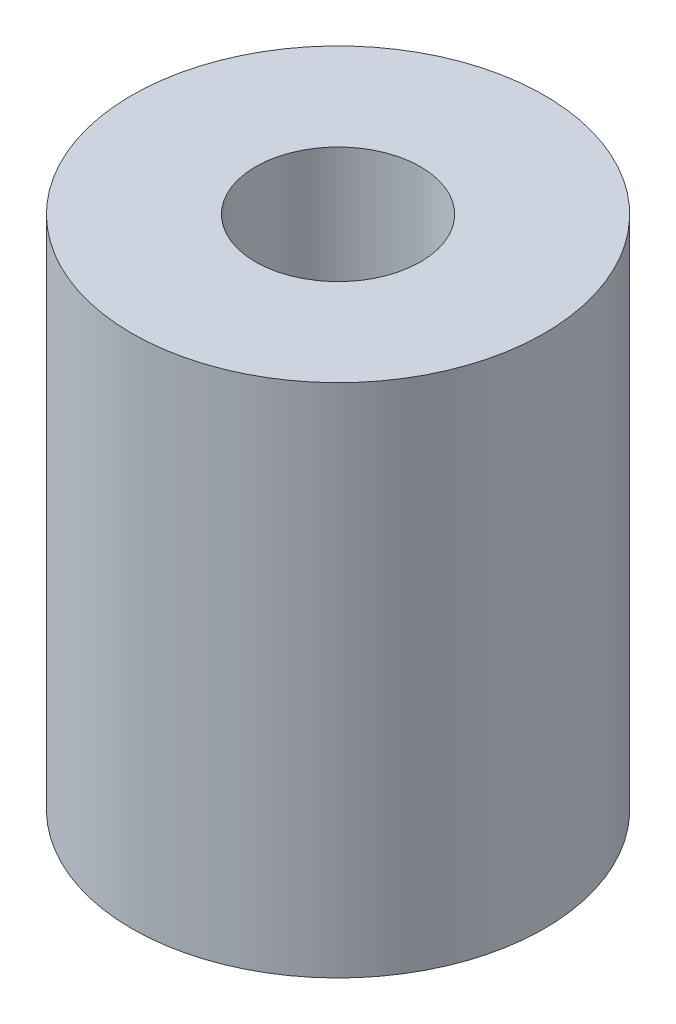
from build123d import *

# Parameters (mm, degrees)
SKETCH1_R           = 10
BOSS_EXTRUDE1_DEPTH = 25
SKETCH2_R           = 4
CUT_EXTRUDE1_DEPTH  = 9
SKETCH3_R           = 2.5
CUT_EXTRUDE2_DEPTH  = 11


with BuildPart() as part:
    # Sketch1 → Boss-Extrude1 (new body)
    with BuildSketch(Plane(origin=(0, 0, 0), x_dir=(1, 0, 0), z_dir=(0, 1, 0))):
        with Locations(Location((0, 0, 0), (0, 0, 270))):
            Circle(SKETCH1_R)
    extrude(amount=BOSS_EXTRUDE1_DEPTH)

    # Sketch2 → Cut-Extrude1 (cut)
    with BuildSketch(Plane(origin=(0, 25, 0), x_dir=(1, 0, 0), z_dir=(0, 1, 0))):
        with Locations(Location((0, 0, 0), (0, 0, 270))):
            Circle(SKETCH2_R)
    extrude(amount=-CUT_EXTRUDE1_DEPTH, mode=Mode.SUBTRACT)

    # Sketch3 → Cut-Extrude2 (cut)
    with BuildSketch(Plane(origin=(0, 0, 0), x_dir=(-1, 0, 0), z_dir=(0, -1, 0))):
        with Locations(Location((0, 0, 0), (0, 0, 90))):
            Circle(SKETCH3_R)
    extrude(amount=-CUT_EXTRUDE2_DEPTH, mode=Mode.SUBTRACT)


solid = part.part
